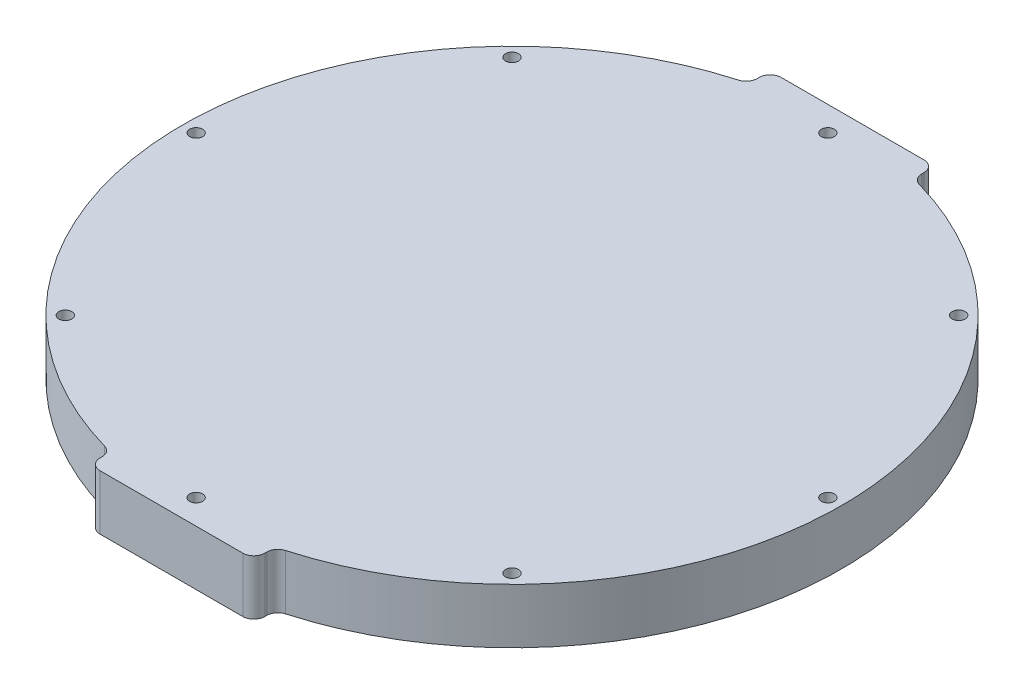
from build123d import *

# Parameters (mm, degrees)
SKETCH2_R                = 76.2
BOSS_EXTRUDE1_DEPTH      = 12.7
BOSS_EXTRUDE2_DEPTH      = 78.74
BOSS_EXTRUDE2_DEPTH_BACK = 78.74
FILLET1_R                = 2.54
SKETCH4_R                = 1.50114
CUT_EXTRUDE1_DEPTH       = 111.307377813


with BuildPart() as part:
    # Sketch2 → Boss-Extrude1 (new body)
    with BuildSketch(Plane(origin=(0, 0, 0), x_dir=(1, 0, 0), z_dir=(0, 1, 0))):
        with Locations(Location((0, 0, 0), (0, 0, 270))):
            Circle(SKETCH2_R)
    extrude(amount=BOSS_EXTRUDE1_DEPTH)

    # Sketch3 → Boss-Extrude2 (add, two sides: drawn at the far end of the back side and taken through both)
    with BuildSketch(Plane.XY.offset(-BOSS_EXTRUDE2_DEPTH_BACK)):
        Polygon((0, 0), (-19.05, 0), (-19.05, 12.7), (19.05, 12.7), (19.05, 0), align=None)
    extrude(amount=BOSS_EXTRUDE2_DEPTH + BOSS_EXTRUDE2_DEPTH_BACK)

    # Fillet1
    fillet1_edges = [part.edges().sort_by_distance(p)[0] for p in [
        (-19.05, 6.35, -78.74),
        (19.05, 6.35, -78.74),
        (-19.05, 6.35, -73.780332745),
        (-19.05, 6.35, 73.780332745),
        (19.05, 6.35, 73.780332745),
        (19.05, 6.35, -73.780332745),
        (19.05, 6.35, 78.74),
        (-19.05, 6.35, 78.74),
    ]]
    fillet(fillet1_edges, radius=FILLET1_R)

    # Sketch4 → Cut-Extrude1 (cut, through all)
    with BuildSketch(Plane(origin=(0, 12.7, 0), x_dir=(1, 0, 0), z_dir=(0, 1, 0))):
        with Locations(Location((73.025, 0, 0), (0, 0, 270))):
            Circle(SKETCH4_R)
        with Locations(Location((51.636472696, -51.636472696, 0), (0, 0, 270))):
            Circle(SKETCH4_R)
        with Locations(Location((0, -73.025, 0), (0, 0, 270))):
            Circle(SKETCH4_R)
        with Locations(Location((-51.636472696, -51.636472696, 0), (0, 0, 270))):
            Circle(SKETCH4_R)
        with Locations(Location((-73.025, 0, 0), (0, 0, 270))):
            Circle(SKETCH4_R)
        with Locations(Location((-51.636472696, 51.636472696, 0), (0, 0, 270))):
            Circle(SKETCH4_R)
        with Locations(Location((0, 73.025, 0), (0, 0, 270))):
            Circle(SKETCH4_R)
        with Locations(Location((51.636472696, 51.636472696, 0), (0, 0, 270))):
            Circle(SKETCH4_R)
    extrude(amount=-CUT_EXTRUDE1_DEPTH, mode=Mode.SUBTRACT)


solid = part.part
